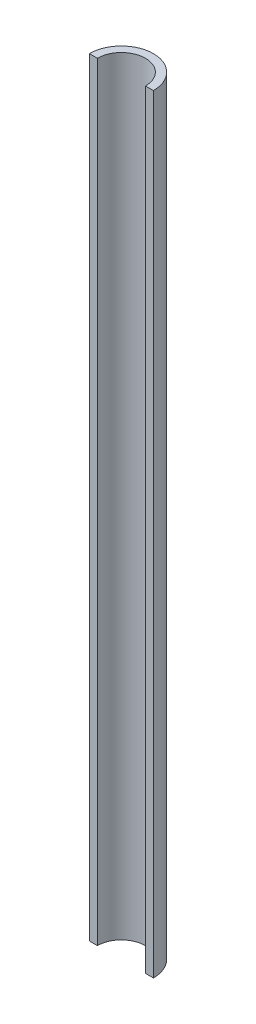
from build123d import *

# Parameters (mm, degrees)
BOSS_EXTRUDE1_DEPTH = 76.2


with BuildPart() as part:
    # Sketch1 → Boss-Extrude1 (new body)
    with BuildSketch(Plane(origin=(0, 0, 0), x_dir=(1, 0, 0), z_dir=(0, 1, 0))):
        with BuildLine():
            Line((-3.175, 0), (-2.38125, 0))
            ThreePointArc((-2.38125, 0), (0, 2.38125), (2.38125, 0))
            Line((2.38125, 0), (3.175, 0))
            ThreePointArc((3.175, 0), (0, 3.175), (-3.175, 0))
        make_face()
    extrude(amount=BOSS_EXTRUDE1_DEPTH)


solid = part.part
